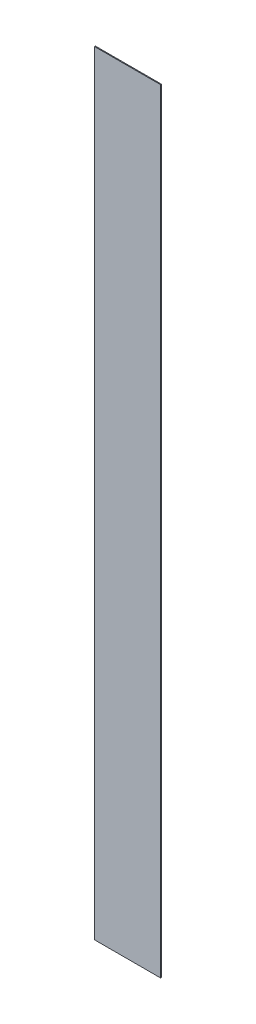
from build123d import *

# Parameters (mm, degrees)
SKETCH1_W           = 150
SKETCH1_H           = 1754
BOSS_EXTRUDE1_DEPTH = 2


with BuildPart() as part:
    # Sketch1 → Boss-Extrude1 (new body)
    with BuildSketch(Plane.XY):
        with Locations((75, 877)):
            Rectangle(SKETCH1_W, SKETCH1_H)
    extrude(amount=BOSS_EXTRUDE1_DEPTH)


solid = part.part
